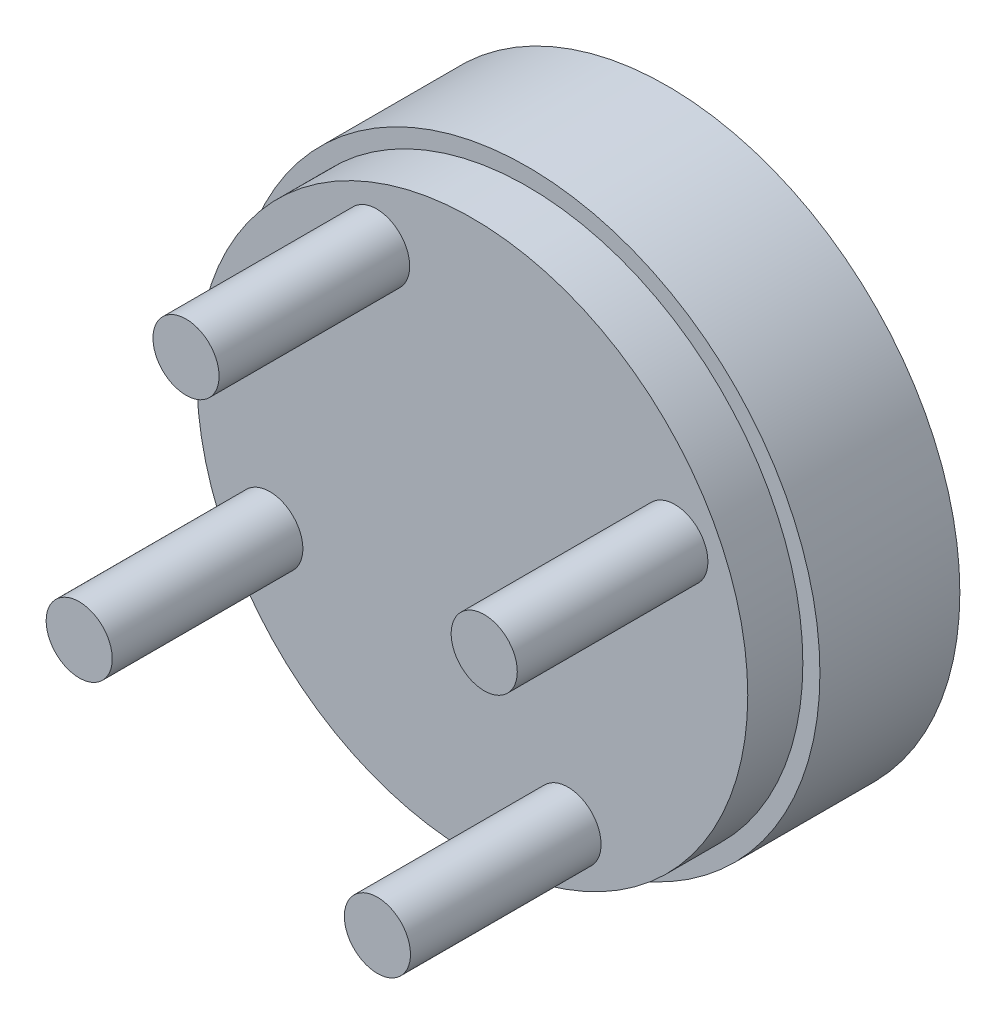
from build123d import *

# Parameters (mm, degrees)
ESQUISSE1_R                  = 53.1
BOSS_EXTRU_1_DEPTH           = 25.4
ESQUISSE2_R                  = 50
BOSS_EXTRU_2_DEPTH           = 10
ESQUISSE3_R                  = 6
BOSS_EXTRU_3_DEPTH           = 34.6
R_P_TITION_CIRCULAIRE1_COUNT = 4


with BuildPart() as part:
    # Esquisse1 → Boss.-Extru.1 (new body)
    with BuildSketch(Plane.XY):
        Circle(ESQUISSE1_R)
    extrude(amount=BOSS_EXTRU_1_DEPTH)

    # Esquisse2 → Boss.-Extru.2 (add)
    with BuildSketch(Plane.XY.offset(25.4)):
        Circle(ESQUISSE2_R)
    extrude(amount=BOSS_EXTRU_2_DEPTH)

    # Esquisse3 → Boss.-Extru.3 (add)
    with BuildSketch(Plane.XY.offset(35.4)):
        with Locations((36.76305328, 17.369902519)):
            Circle(ESQUISSE3_R)
    boss_extru_3 = extrude(amount=BOSS_EXTRU_3_DEPTH)

    # Répétition circulaire1: Boss.-Extru.3 ×4 about axis
    r_p_tition_circulaire1_axis = Axis((0, 0, 25.4), (0, 0, -1))
    for i in range(1, R_P_TITION_CIRCULAIRE1_COUNT):
        add(boss_extru_3.rotate(r_p_tition_circulaire1_axis, i * 360 / R_P_TITION_CIRCULAIRE1_COUNT))


solid = part.part
